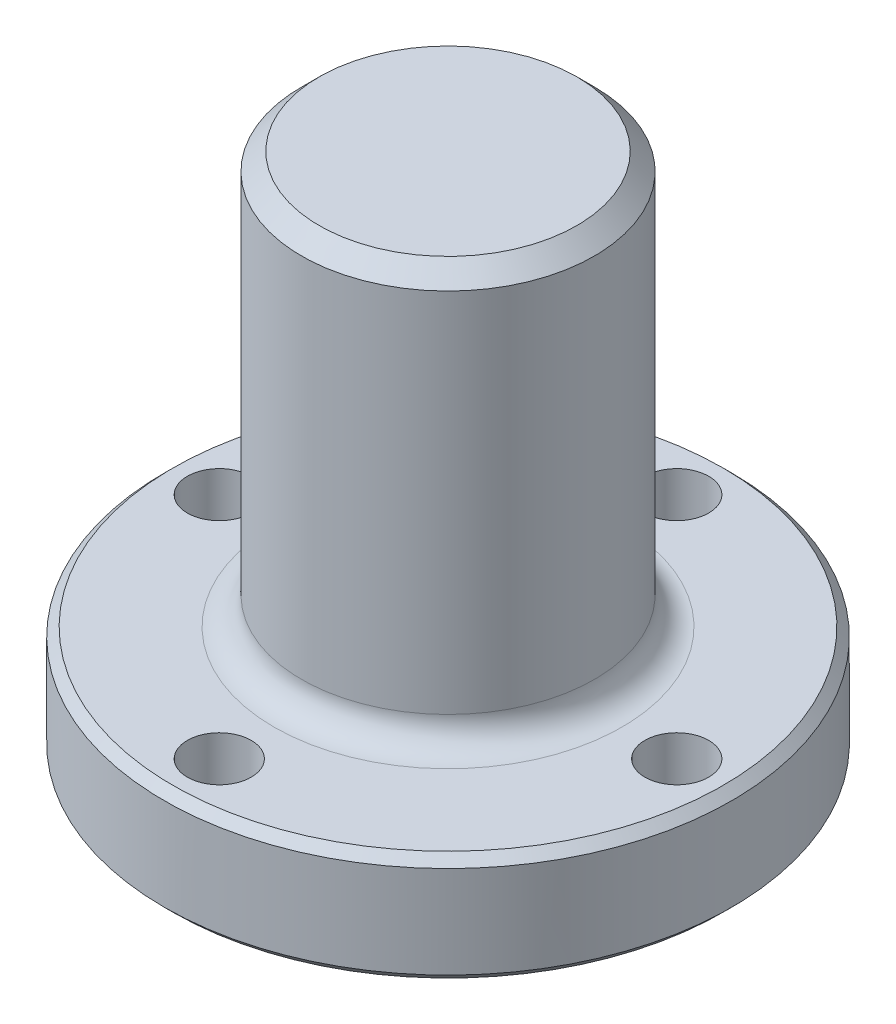
from build123d import *

# Parameters (mm, degrees)
FILLET1_R          = 2.3876
CHAMFER1_SIZE      = 0.762
CHAMFER2_SIZE      = 1.524
CUT_EXTRUDE2_START = -10.6807
SKETCH2_R          = 2.7686
CUT_EXTRUDE2_DEPTH = 10.6807
CUT_EXTRUDE4_START = -10.6807
SKETCH3_R          = 2.7686
CUT_EXTRUDE4_DEPTH = 10.6807


with BuildPart() as part:
    # Sketch1 → Revolve1 (revolve)
    with BuildSketch(Plane(origin=(0, 0, 0), x_dir=(0, 1, 0), z_dir=(0, 0, 1)), mode=Mode.PRIVATE) as revolve1_sk:
        Polygon((-25.0317, 0), (-25.0317, 8.7122), (-20.2057, 8.7122), (-20.2057, 24.6126), (-10.6807, 24.6126), (-10.6807, 12.7), (25.0317, 12.7), (25.0317, 0), align=None)
    revolve(revolve1_sk.sketch.rotate(Axis((0, -50.4317, 0), (0, 1, 0)), 270), axis=Axis((0, -50.4317, 0), (0, 1, 0)))

    # Fillet1
    fillet1_edges = [part.edges().sort_by_distance(p)[0] for p in [
        (0, -10.6807, 12.7),
    ]]
    fillet(fillet1_edges, radius=FILLET1_R)

    # Chamfer1
    chamfer1_edges = [part.edges().sort_by_distance(p)[0] for p in [
        (0, -10.6807, 24.6126),
        (0, -20.2057, 24.6126),
        (0, -25.0317, 8.7122),
    ]]
    chamfer(chamfer1_edges, length=CHAMFER1_SIZE)

    # Chamfer2
    chamfer2_edges = [part.edges().sort_by_distance(p)[0] for p in [
        (0, 25.0317, 12.7),
    ]]
    chamfer(chamfer2_edges, length=CHAMFER2_SIZE)

    # Sketch2 → Cut-Extrude2 (cut)
    with BuildSketch(Plane(origin=(0, 0, 0), x_dir=(-1, 0, 0), z_dir=(0, 1, 0)).offset(CUT_EXTRUDE2_START)):
        with Locations(Location((19.8374, 0, 0), (0, 0, 90))):
            Circle(SKETCH2_R)
    extrude(amount=-CUT_EXTRUDE2_DEPTH, mode=Mode.SUBTRACT)

    # Sketch3 → Cut-Extrude4 (cut)
    with BuildSketch(Plane(origin=(0, 0, 0), x_dir=(-1, 0, 0), z_dir=(0, 1, 0)).offset(CUT_EXTRUDE4_START)):
        with Locations(Location((0, 19.8374, 0), (0, 0, 90))):
            Circle(SKETCH3_R)
        with Locations(Location((-19.8374, 0, 0), (0, 0, 90))):
            Circle(SKETCH3_R)
        with Locations(Location((0, -19.8374, 0), (0, 0, 90))):
            Circle(SKETCH3_R)
    extrude(amount=-CUT_EXTRUDE4_DEPTH, mode=Mode.SUBTRACT)


solid = part.part
